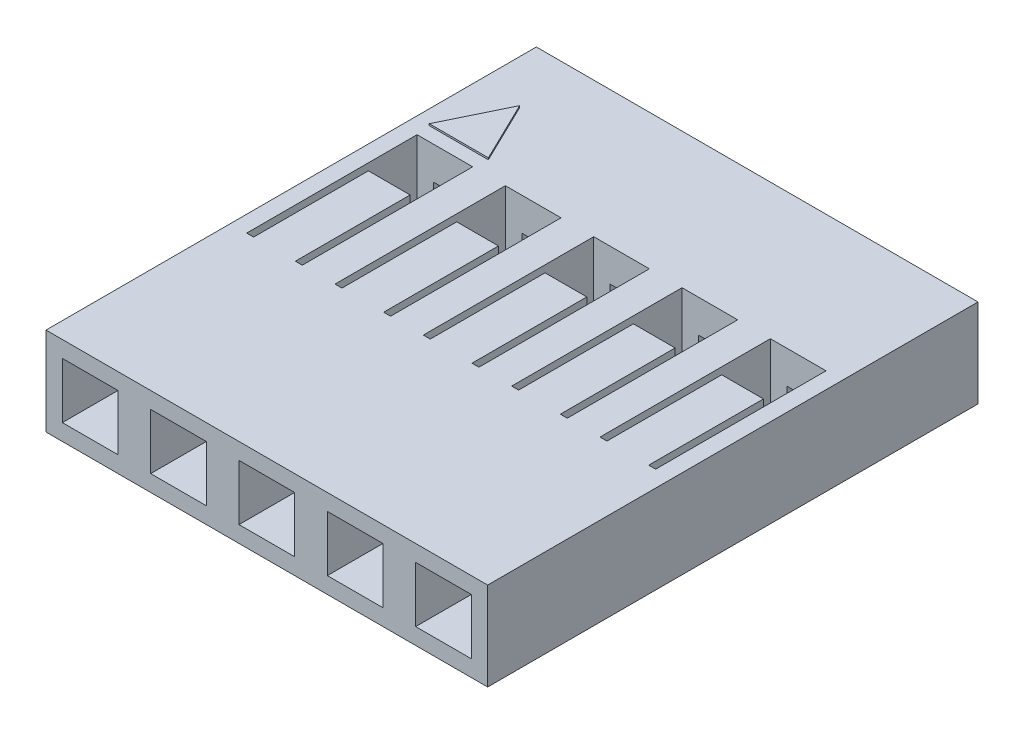
from build123d import *

# Parameters (mm, degrees)
SKETCH1_W                  = 2.54
SKETCH1_H                  = 2.54
SKETCH1_W_2                = 0.65
SKETCH1_H_2                = 0.65
BOSS_EXTRUDE1_DEPTH        = 14.1
CHAMFER1_SIZE              = 0.5
SKETCH4_W                  = 1.6
SKETCH4_H                  = 1.6
CUT_EXTRUDE2_DEPTH         = 1.5
CUT_EXTRUDE1_START         = -10.2
SKETCH2_W                  = 1.6
SKETCH2_H                  = 1.6
CUT_EXTRUDE1_DEPTH         = 10.2
BOSS_EXTRUDE2_DEPTH        = 0.05
SKETCH5_W                  = 0.2
SKETCH5_H                  = 3.3
CUT_EXTRUDE3_DEPTH         = 0.47
LPATTERN1_COUNT            = 5
LPATTERN1_PITCH            = 2.54
CHAMFER1_OF_LPATTERN1_SIZE = 0.5


with BuildPart() as part:
    # Sketch1 → Boss-Extrude1 (new body)
    with BuildSketch(Plane.XY):
        with Locations((1.27, 1.27)):
            Rectangle(SKETCH1_W, SKETCH1_H)
        with Locations((1.27, 1.27)):
            Rectangle(SKETCH1_W_2, SKETCH1_H_2, mode=Mode.SUBTRACT)
    boss_extrude1 = extrude(amount=BOSS_EXTRUDE1_DEPTH)

    # Chamfer1
    chamfer1_edges = [part.edges().sort_by_distance(p)[0] for p in [
        (1.595, 1.27, 0),
        (1.27, 1.595, 0),
        (0.945, 1.27, 0),
        (1.27, 0.945, 0),
    ]]
    chamfer(chamfer1_edges, length=CHAMFER1_SIZE)

    # Sketch4 → Cut-Extrude2 (cut)
    with BuildSketch(Plane(origin=(0, 2.54, 0), x_dir=(1, 0, 0), z_dir=(0, 1, 0))):
        with Locations((1.27, -4.7)):
            Rectangle(SKETCH4_W, SKETCH4_H)
    cut_extrude2 = extrude(amount=-CUT_EXTRUDE2_DEPTH, mode=Mode.SUBTRACT)

    # Sketch2 → Cut-Extrude1 (cut)
    with BuildSketch(Plane.XY.offset(14.1).offset(CUT_EXTRUDE1_START)):
        with Locations((1.27, 1.27)):
            Rectangle(SKETCH2_W, SKETCH2_H)
    cut_extrude1 = extrude(amount=CUT_EXTRUDE1_DEPTH, mode=Mode.SUBTRACT)

    # Sketch3 → Boss-Extrude2 (add)
    with BuildSketch(Plane(origin=(0, 2.54, 0), x_dir=(1, 0, 0), z_dir=(0, 1, 0))):
        Polygon((2.12, -3.5), (0.42, -3.5), (1.27, -1.75), align=None)
    extrude(amount=BOSS_EXTRUDE2_DEPTH)

    # Sketch5 → Cut-Extrude3 (cut)
    with BuildSketch(Plane(origin=(0, 2.54, 0), x_dir=(1, 0, 0), z_dir=(0, 1, 0))):
        with Locations((0.57, -7.15)):
            Rectangle(SKETCH5_W, SKETCH5_H)
        with Locations((1.97, -7.15)):
            Rectangle(SKETCH5_W, SKETCH5_H)
    cut_extrude3 = extrude(amount=-CUT_EXTRUDE3_DEPTH, mode=Mode.SUBTRACT)

    # LPattern1: Boss-Extrude1, Cut-Extrude2, Cut-Extrude1, Cut-Extrude3 ×5
    with Locations(*[(i * LPATTERN1_PITCH, 0, 0) for i in range(1, LPATTERN1_COUNT)]):
        add(boss_extrude1)
        add(cut_extrude2, mode=Mode.SUBTRACT)
        add(cut_extrude1, mode=Mode.SUBTRACT)
        add(cut_extrude3, mode=Mode.SUBTRACT)

    # Chamfer1 of LPattern1
    chamfer1_of_lpattern1_edges = [part.edges().sort_by_distance(p)[0] for p in [
        (4.135, 1.27, 0),
        (3.81, 1.595, 0),
        (3.485, 1.27, 0),
        (3.81, 0.945, 0),
        (6.675, 1.27, 0),
        (6.35, 1.595, 0),
        (6.025, 1.27, 0),
        (6.35, 0.945, 0),
        (9.215, 1.27, 0),
        (8.89, 1.595, 0),
        (8.565, 1.27, 0),
        (8.89, 0.945, 0),
        (11.755, 1.27, 0),
        (11.43, 1.595, 0),
        (11.105, 1.27, 0),
        (11.43, 0.945, 0),
    ]]
    chamfer(chamfer1_of_lpattern1_edges, length=CHAMFER1_OF_LPATTERN1_SIZE)


solid = part.part
